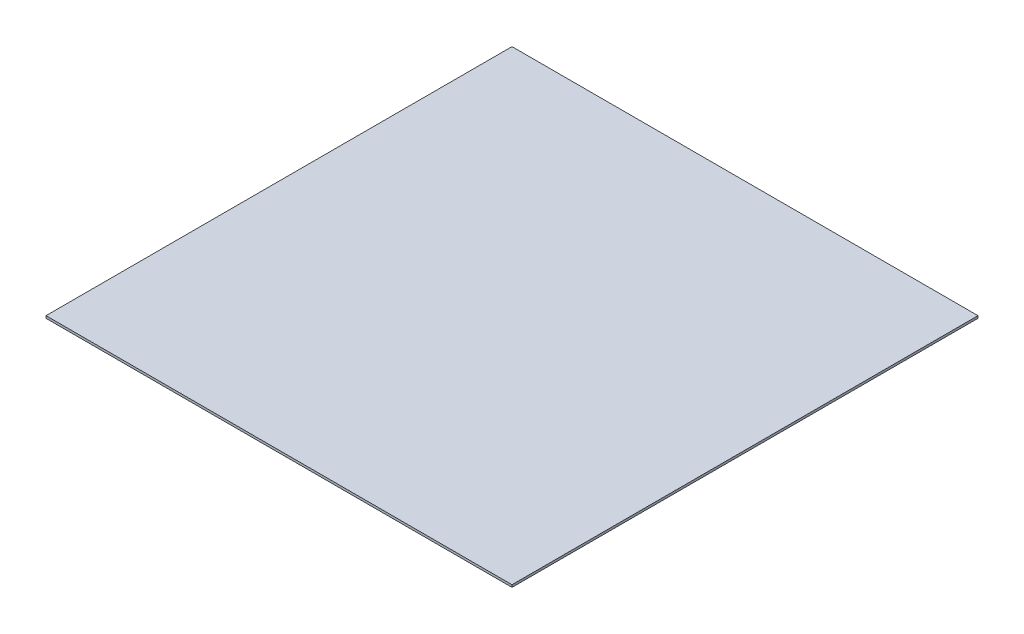
from build123d import *

# Parameters (mm, degrees)
SKETCH1_W                  = 320
SKETCH1_H                  = 1.6
KUTU_TABAN_320X320_1_DEPTH = 320


with BuildPart() as part:
    # Sketch1 → KUTU_taban_320x320_1 (new body)
    with BuildSketch(Plane.XY):
        with Locations((160, 0.8)):
            Rectangle(SKETCH1_W, SKETCH1_H)
    extrude(amount=-KUTU_TABAN_320X320_1_DEPTH)


solid = part.part
